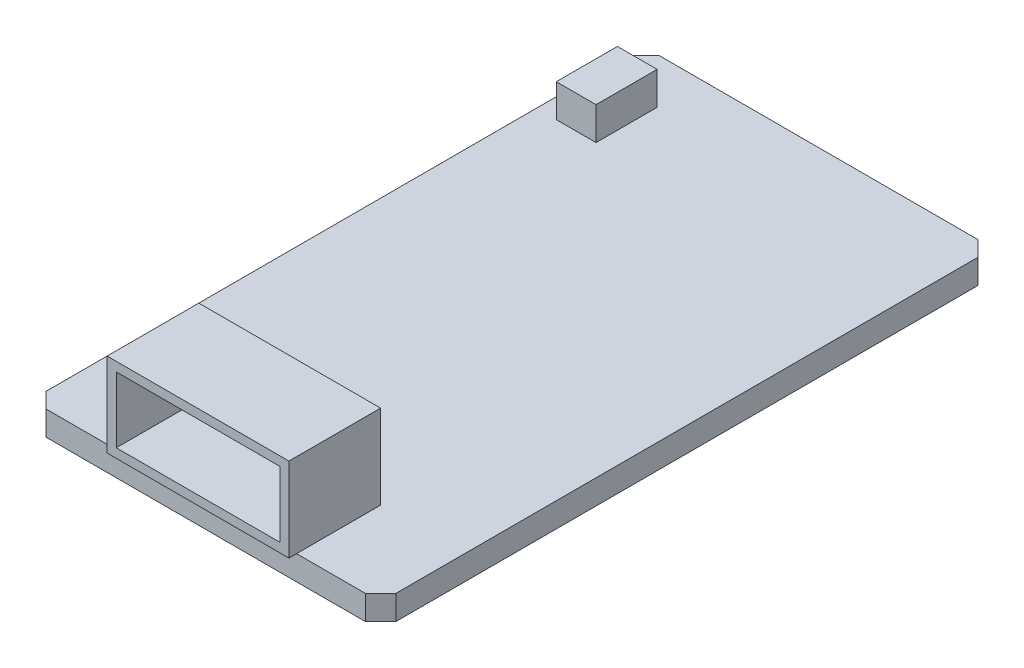
from build123d import *

# Parameters (mm, degrees)
SKETCH1_W                = 22.9
SKETCH1_H                = 40.1
BOSS_EXTRUDE1_DEPTH      = 1.6
BOSS_EXTRUDE2_DEPTH      = 0.5
BOSS_EXTRUDE2_DEPTH_BACK = 5.5
SKETCH2_W                = 11.9
SKETCH2_H                = 5.5
SHELL1_T                 = -0.6
CHAMFER1_SIZE            = 1
SKETCH3_W                = 2.6
SKETCH3_H                = 4
BOSS_EXTRUDE3_DEPTH      = 2.15


with BuildPart() as part:
    # Sketch1 → Boss-Extrude1 (new body)
    with BuildSketch(Plane(origin=(0, 0, 0), x_dir=(1, 0, 0), z_dir=(0, 1, 0))):
        Rectangle(SKETCH1_W, SKETCH1_H)
    extrude(amount=BOSS_EXTRUDE1_DEPTH)

    # Chamfer1
    chamfer1_edges = [part.edges().sort_by_distance(p)[0] for p in [
        (-11.45, 0.8, -20.05),
        (11.45, 0.8, -20.05),
        (11.45, 0.8, 20.05),
        (-11.45, 0.8, 20.05),
    ]]
    chamfer(chamfer1_edges, length=CHAMFER1_SIZE)

    # Sketch3 → Boss-Extrude3 (add)
    with BuildSketch(Plane(origin=(0, 1.6, 0), x_dir=(1, 0, 0), z_dir=(0, 1, 0))):
        with Locations((-8.85, 15.05)):
            Rectangle(SKETCH3_W, SKETCH3_H)
    extrude(amount=BOSS_EXTRUDE3_DEPTH)


with BuildPart() as body_2:
    # Sketch2 → Boss-Extrude2 (new, two sides: drawn at the far end of the back side and taken through both)
    with BuildSketch(Plane.XY.offset(20.05).offset(-BOSS_EXTRUDE2_DEPTH_BACK)):
        with Locations((0, 4.35)):
            Rectangle(SKETCH2_W, SKETCH2_H)
    extrude(amount=BOSS_EXTRUDE2_DEPTH + BOSS_EXTRUDE2_DEPTH_BACK)

    # Shell1
    shell1_openings = [body_2.faces().sort_by_distance(p)[0] for p in [
        (0, 4.35, 20.55),
    ]]
    offset(amount=SHELL1_T, openings=shell1_openings, kind=Kind.INTERSECTION)


solid = Compound([part.part, body_2.part])
